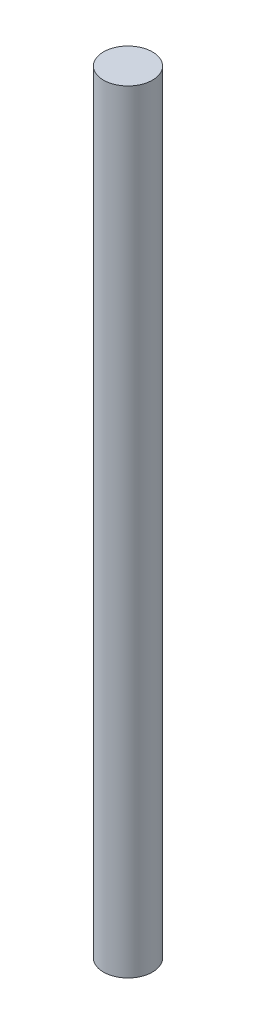
from build123d import *

# Parameters (mm, degrees)
SKETCH1_R           = 4
BOSS_EXTRUDE1_DEPTH = 126.2


with BuildPart() as part:
    # Sketch1 → Boss-Extrude1 (new body)
    with BuildSketch(Plane(origin=(0, 0, 0), x_dir=(1, 0, 0), z_dir=(0, 1, 0))):
        with Locations(Location((0, 0, 0), (0, 0, 270))):
            Circle(SKETCH1_R)
    extrude(amount=BOSS_EXTRUDE1_DEPTH)


solid = part.part
